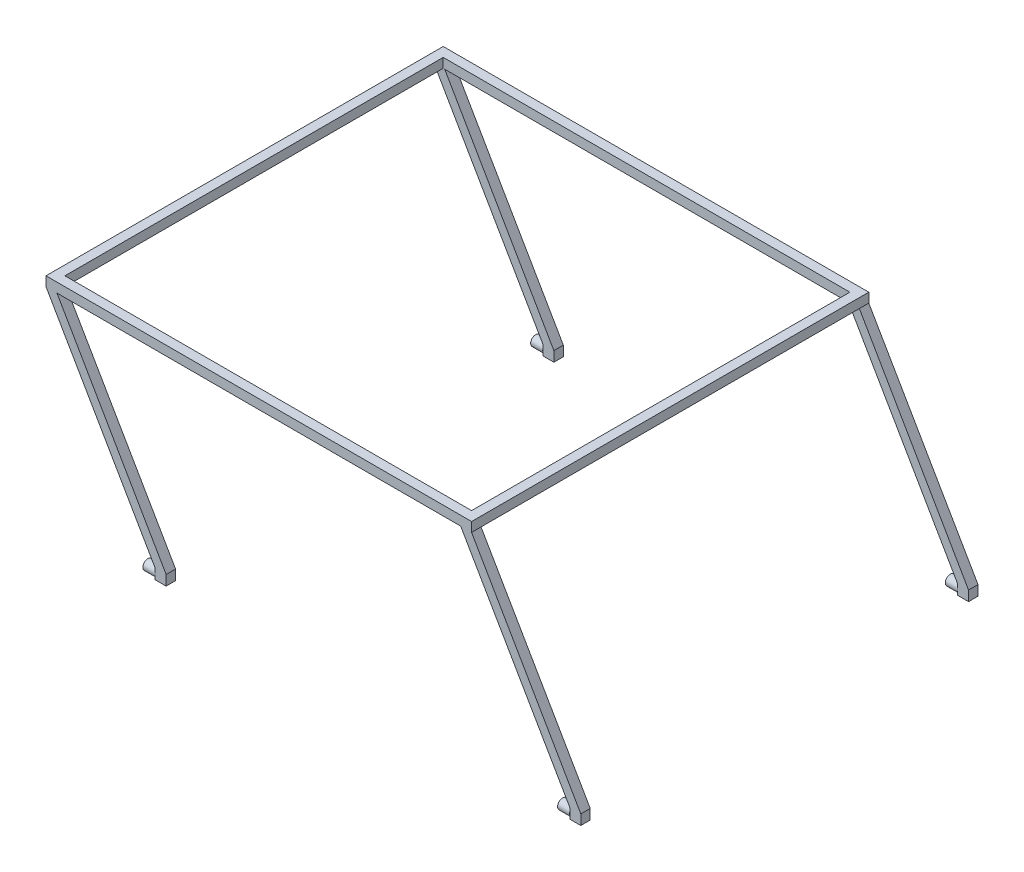
from build123d import *

# Parameters (mm, degrees)
SKETCH1_W           = 450
SKETCH1_H           = 420
SKETCH1_W_2         = 430
SKETCH1_H_2         = 400
BOSS_EXTRUDE1_DEPTH = 10
BOSS_EXTRUDE2_DEPTH = 10
SKETCH8_W           = 11.547005384
SKETCH8_H           = 10
BOSS_EXTRUDE3_DEPTH = 10.67
SKETCH9_R           = 5.335
BOSS_EXTRUDE4_DEPTH = 12.7
SKETCH10_R          = 5.335
BOSS_EXTRUDE5_DEPTH = 12.7


with BuildPart() as part:
    # Sketch1 → Boss-Extrude1 (new body)
    with BuildSketch(Plane(origin=(0, 0, 0), x_dir=(1, 0, 0), z_dir=(0, 1, 0))):
        Rectangle(SKETCH1_W, SKETCH1_H)
        Rectangle(SKETCH1_W_2, SKETCH1_H_2, mode=Mode.SUBTRACT)
    extrude(amount=BOSS_EXTRUDE1_DEPTH)

    # Sketch4 → Boss-Extrude2 (add)
    with BuildSketch(Plane.XY.offset(210)):
        Polygon((-225, 0), (-109.529946162, -200), (-97.982940778, -200), (-213.452994616, 0), align=None)
        Polygon((225, 0), (340.470053838, -200), (328.923048454, -200), (213.452994616, 0), align=None)
    boss_extrude2 = extrude(amount=-BOSS_EXTRUDE2_DEPTH)

    # Mirror1: Boss-Extrude2 across plane
    add(boss_extrude2.mirror(Plane.XY))

    # Sketch8 → Boss-Extrude3 (add)
    with BuildSketch(Plane.XZ.offset(200)):
        with Locations((-103.75644347, 205)):
            Rectangle(SKETCH8_W, SKETCH8_H)
        with Locations((334.696551146, 205)):
            Rectangle(SKETCH8_W, SKETCH8_H)
    boss_extrude3 = extrude(amount=BOSS_EXTRUDE3_DEPTH)

    # Mirror2: Boss-Extrude3 across plane
    add(boss_extrude3.mirror(Plane.XY))

    # Sketch9 → Boss-Extrude4 (add)
    with BuildSketch(Plane.ZY.offset(109.529946162)):
        with Locations(Location((205.028494261, -205.335, 0), (0, 0, 199.516018921))):
            Circle(SKETCH9_R)
    boss_extrude4 = extrude(amount=BOSS_EXTRUDE4_DEPTH)

    # Sketch10 → Boss-Extrude5 (add)
    with BuildSketch(Plane.ZY.offset(-328.923048454)):
        with Locations(Location((205, -205.335, 0), (0, 0, 159.587697496))):
            Circle(SKETCH10_R)
    boss_extrude5 = extrude(amount=BOSS_EXTRUDE5_DEPTH)

    # Mirror3: Boss-Extrude4, Boss-Extrude5 across plane
    add(boss_extrude4.mirror(Plane.XY))
    add(boss_extrude5.mirror(Plane.XY))


solid = part.part
